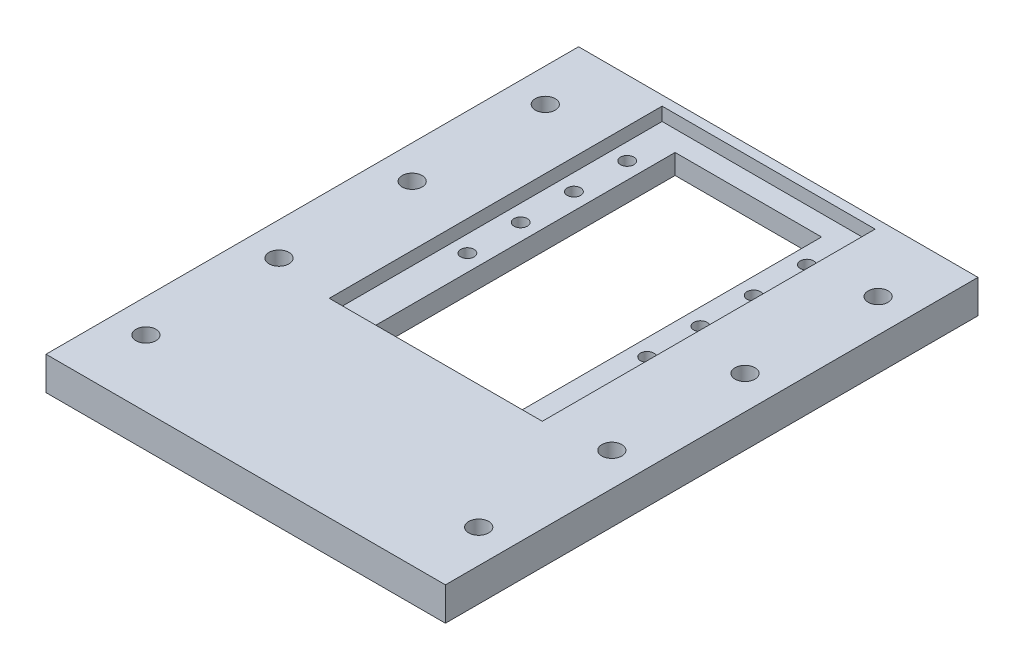
from build123d import *

# Parameters (mm, degrees)
SKETCH3_W           = 60
SKETCH3_H           = 80
SKETCH3_R           = 1
SKETCH3_R_2         = 1.5
SKETCH3_W_2         = 22
SKETCH3_H_2         = 45
BOSS_EXTRUDE1_DEPTH = 5
SKETCH4_W           = 32
SKETCH4_H           = 50
CUT_EXTRUDE1_DEPTH  = 2


with BuildPart() as part:
    # Sketch3 → Boss-Extrude1 (new body)
    with BuildSketch(Plane(origin=(0, 0, 0), x_dir=(1, 0, 0), z_dir=(0, 1, 0))):
        Rectangle(SKETCH3_W, SKETCH3_H)
        with Locations(Location((-13.5, 22.8, 0), (0, 0, 270))):
            Circle(SKETCH3_R, mode=Mode.SUBTRACT)
        with Locations(Location((13.5, 22.8, 0), (0, 0, 270))):
            Circle(SKETCH3_R, mode=Mode.SUBTRACT)
        with Locations(Location((-13.5, 14.8, 0), (0, 0, 270))):
            Circle(SKETCH3_R, mode=Mode.SUBTRACT)
        with Locations(Location((-13.5, 6.8, 0), (0, 0, 270))):
            Circle(SKETCH3_R, mode=Mode.SUBTRACT)
        with Locations(Location((13.5, 14.8, 0), (0, 0, 270))):
            Circle(SKETCH3_R, mode=Mode.SUBTRACT)
        with Locations(Location((13.5, 6.8, 0), (0, 0, 270))):
            Circle(SKETCH3_R, mode=Mode.SUBTRACT)
        with Locations(Location((-13.5, 30.8, 0), (0, 0, 270))):
            Circle(SKETCH3_R, mode=Mode.SUBTRACT)
        with Locations(Location((13.5, 30.8, 0), (0, 0, 270))):
            Circle(SKETCH3_R, mode=Mode.SUBTRACT)
        with Locations(Location((-25, 30, 0), (0, 0, 270))):
            Circle(SKETCH3_R_2, mode=Mode.SUBTRACT)
        with Locations(Location((25, 30, 0), (0, 0, 270))):
            Circle(SKETCH3_R_2, mode=Mode.SUBTRACT)
        with Locations(Location((-25, 10, 0), (0, 0, 270))):
            Circle(SKETCH3_R_2, mode=Mode.SUBTRACT)
        with Locations(Location((-25, -10, 0), (0, 0, 270))):
            Circle(SKETCH3_R_2, mode=Mode.SUBTRACT)
        with Locations(Location((-25, -30, 0), (0, 0, 270))):
            Circle(SKETCH3_R_2, mode=Mode.SUBTRACT)
        with Locations(Location((25, 10, 0), (0, 0, 270))):
            Circle(SKETCH3_R_2, mode=Mode.SUBTRACT)
        with Locations(Location((25, -10, 0), (0, 0, 270))):
            Circle(SKETCH3_R_2, mode=Mode.SUBTRACT)
        with Locations(Location((25, -30, 0), (0, 0, 270))):
            Circle(SKETCH3_R_2, mode=Mode.SUBTRACT)
        with Locations((0, 13)):
            Rectangle(SKETCH3_W_2, SKETCH3_H_2, mode=Mode.SUBTRACT)
    extrude(amount=BOSS_EXTRUDE1_DEPTH)

    # Sketch4 → Cut-Extrude1 (cut)
    with BuildSketch(Plane(origin=(0, 5, 0), x_dir=(1, 0, 0), z_dir=(0, 1, 0))):
        with Locations((0, 13.55)):
            Rectangle(SKETCH4_W, SKETCH4_H)
    extrude(amount=-CUT_EXTRUDE1_DEPTH, mode=Mode.SUBTRACT)


solid = part.part
